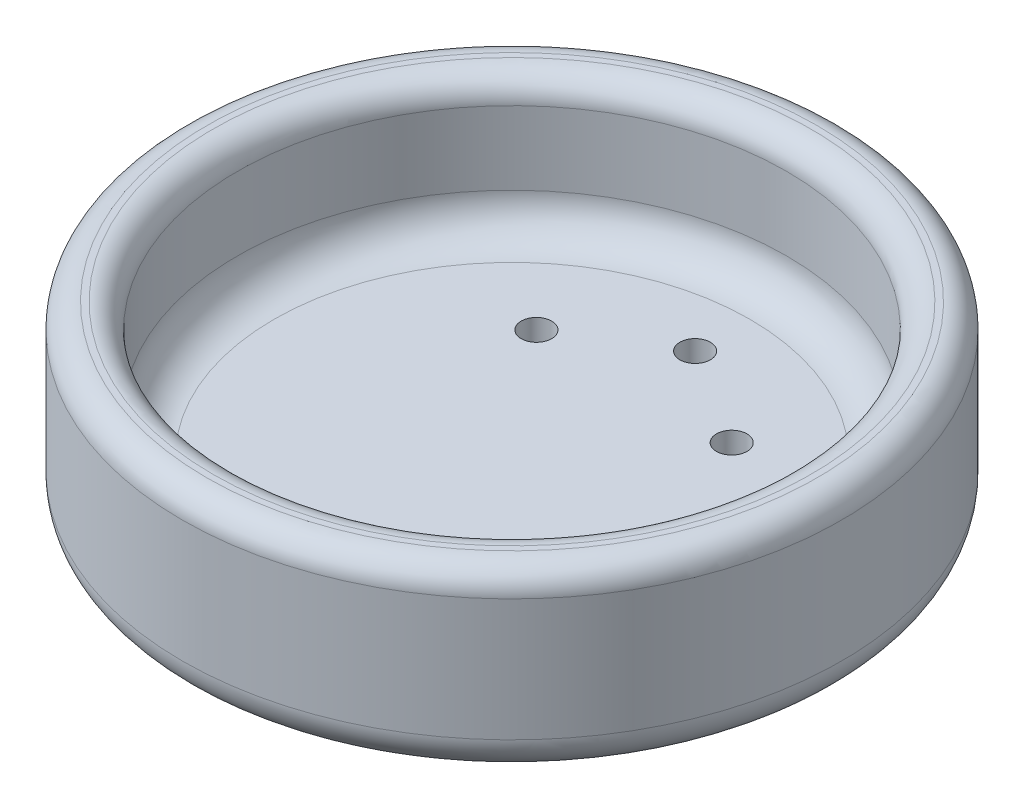
from build123d import *

# Parameters (mm, degrees)
SKETCH1_R           = 27
BOSS_EXTRUDE1_DEPTH = 15
SKETCH2_R           = 22.5
CUT_EXTRUDE1_DEPTH  = 11
FILLET1_R           = 3
FILLET2_R           = 3
FILLET3_R           = 2
FILLET4_R           = 2
SKETCH4_R           = 1.25
CUT_EXTRUDE2_DEPTH  = 11


with BuildPart() as part:
    # Sketch1 → Boss-Extrude1 (new body)
    with BuildSketch(Plane(origin=(0, 0, 0), x_dir=(1, 0, 0), z_dir=(0, 1, 0))):
        with Locations(Location((0, 0, 0), (0, 0, 270))):
            Circle(SKETCH1_R)
    extrude(amount=BOSS_EXTRUDE1_DEPTH)

    # Sketch2 → Cut-Extrude1 (cut)
    with BuildSketch(Plane(origin=(0, 15, 0), x_dir=(1, 0, 0), z_dir=(0, 1, 0))):
        with Locations(Location((0, 0, 0), (0, 0, 270))):
            Circle(SKETCH2_R)
    extrude(amount=-CUT_EXTRUDE1_DEPTH, mode=Mode.SUBTRACT)

    # Fillet1
    fillet1_edges = [part.edges().sort_by_distance(p)[0] for p in [
        (0, 0, -27),
    ]]
    fillet(fillet1_edges, radius=FILLET1_R)

    # Fillet2
    fillet2_edges = [part.edges().sort_by_distance(p)[0] for p in [
        (0, 4, -22.5),
    ]]
    fillet(fillet2_edges, radius=FILLET2_R)

    # Fillet3
    fillet3_edges = [part.edges().sort_by_distance(p)[0] for p in [
        (0, 15, -27),
    ]]
    fillet(fillet3_edges, radius=FILLET3_R)

    # Fillet4
    fillet4_edges = [part.edges().sort_by_distance(p)[0] for p in [
        (0, 15, -22.5),
    ]]
    fillet(fillet4_edges, radius=FILLET4_R)

    # Sketch4 → Cut-Extrude2 (cut)
    with BuildSketch(Plane(origin=(0, 4, 0), x_dir=(1, 0, 0), z_dir=(0, 1, 0))):
        with Locations(Location((-8, 10, 0), (0, 0, 270))):
            Circle(SKETCH4_R)
        with Locations(Location((8, 10, 0), (0, 0, 270))):
            Circle(SKETCH4_R)
        with Locations(Location((0, 15, 0), (0, 0, 270))):
            Circle(SKETCH4_R)
    extrude(amount=-CUT_EXTRUDE2_DEPTH, mode=Mode.SUBTRACT)


solid = part.part
